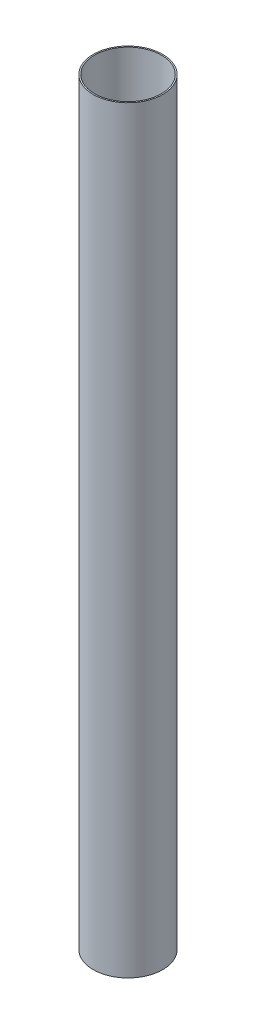
from build123d import *

# Parameters (mm, degrees)
SKETCH1_R           = 39.624
SKETCH1_R_2         = 38.1
BOSS_EXTRUDE1_DEPTH = 863.6


with BuildPart() as part:
    # Sketch1 → Boss-Extrude1 (new body)
    with BuildSketch(Plane(origin=(0, 0, 0), x_dir=(1, 0, 0), z_dir=(0, 1, 0))):
        with Locations(Location((0, 0, 0), (0, 0, 270))):
            Circle(SKETCH1_R)
        with Locations(Location((0, 0, 0), (0, 0, 270))):
            Circle(SKETCH1_R_2, mode=Mode.SUBTRACT)
    extrude(amount=BOSS_EXTRUDE1_DEPTH)


solid = part.part
